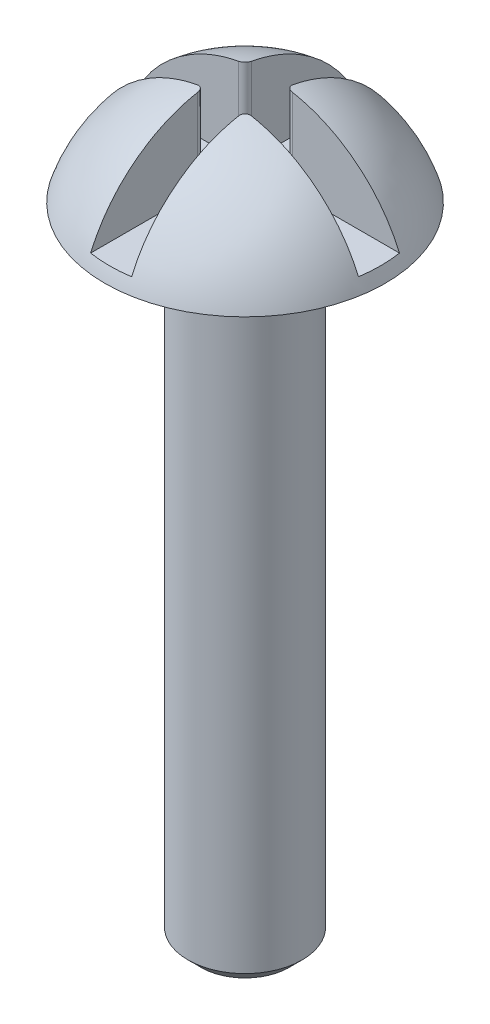
from build123d import *

# Parameters (mm, degrees)
SKETCH3_R        = 1.1303
SHAFT_DEPTH      = 12.7
TIP_SIZE         = 0.254
PHILLIPS_START   = 0.254
PHILLIPS_DEPTH   = 14.041159246
PHILLIPSFILLET_R = 0.127


with BuildPart() as part:
    # Sketch2 → Head (revolve)
    with BuildSketch(Plane(origin=(0, 0, 0), x_dir=(0, 0, -1), z_dir=(1, 0, 0))):
        with BuildLine():
            Line((0, 0), (2.7813, 0))
            ThreePointArc((2.7813, 0), (1.72225533, 1.469884796), (0, 2.032))
            Line((0, 2.032), (0, 0))
        make_face()
    revolve(axis=Axis((0, 0.415157056, 0), (0, -1, 0)))

    # Sketch3 → Shaft (add)
    with BuildSketch(Plane.XZ):
        with Locations(Location((0, 0, 0), (0, 0, 90))):
            Circle(SKETCH3_R)
    extrude(amount=SHAFT_DEPTH)

    # Tip
    tip_edges = [part.edges().sort_by_distance(p)[0] for p in [
        (0, -12.7, -1.1303),
    ]]
    chamfer(tip_edges, length=TIP_SIZE)

    # Sketch4 → Phillips (cut, through all)
    with BuildSketch(Plane(origin=(0, 0, 0), x_dir=(1, 0, 0), z_dir=(0, 1, 0)).offset(PHILLIPS_START)):
        Polygon((-0.4064, 0.4064), (-0.4064, 2.7813), (0.4064, 2.7813), (0.4064, 0.4064), (2.7813, 0.4064), (2.7813, -0.4064), (0.4064, -0.4064), (0.4064, -2.7813), (-0.4064, -2.7813), (-0.4064, -0.4064), (-2.7813, -0.4064), (-2.7813, 0.4064), align=None)
    extrude(amount=PHILLIPS_DEPTH, mode=Mode.SUBTRACT)

    # PhillipsFillet
    phillipsfillet_edges = [part.edges().sort_by_distance(p)[0] for p in [
        (0.4064, 1.114434201, -0.4064),
        (-0.4064, 1.114434201, -0.4064),
        (-0.4064, 1.114434201, 0.4064),
        (0.4064, 1.114434201, 0.4064),
    ]]
    fillet(phillipsfillet_edges, radius=PHILLIPSFILLET_R)


solid = part.part
